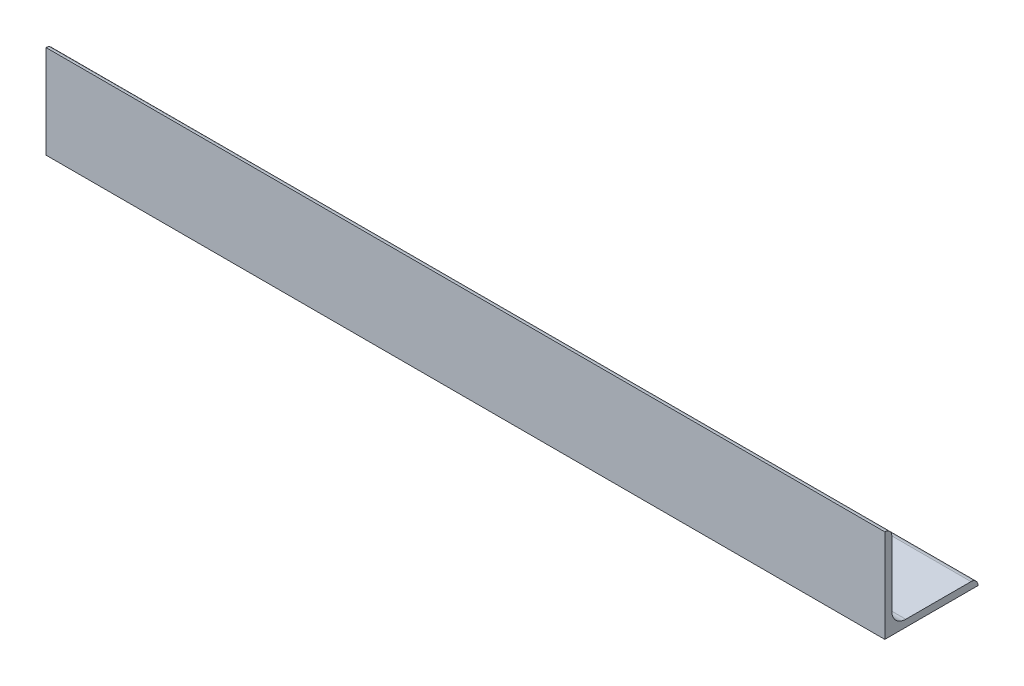
from build123d import *

# Parameters (mm, degrees)
L_ANGLE_EQUAL_40X40X3_11_DEPTH = 360


with BuildPart() as part:
    # Sketch13 → L angle (equal) 40X40X3(11) (new body)
    with BuildSketch(Plane(origin=(0, 0, 0), x_dir=(0, 0, -1), z_dir=(1, 0, 0))):
        with BuildLine():
            Line((0, 40), (0, 0))
            Line((0, 0), (40, 0))
            ThreePointArc((40, 0), (39.121320344, 2.121320344), (37, 3))
            Line((37, 3), (9, 3))
            ThreePointArc((9, 3), (4.757359313, 4.757359313), (3, 9))
            Line((3, 9), (3, 37))
            ThreePointArc((3, 37), (2.121320344, 39.121320344), (0, 40))
        make_face()
    extrude(amount=L_ANGLE_EQUAL_40X40X3_11_DEPTH)


solid = part.part
